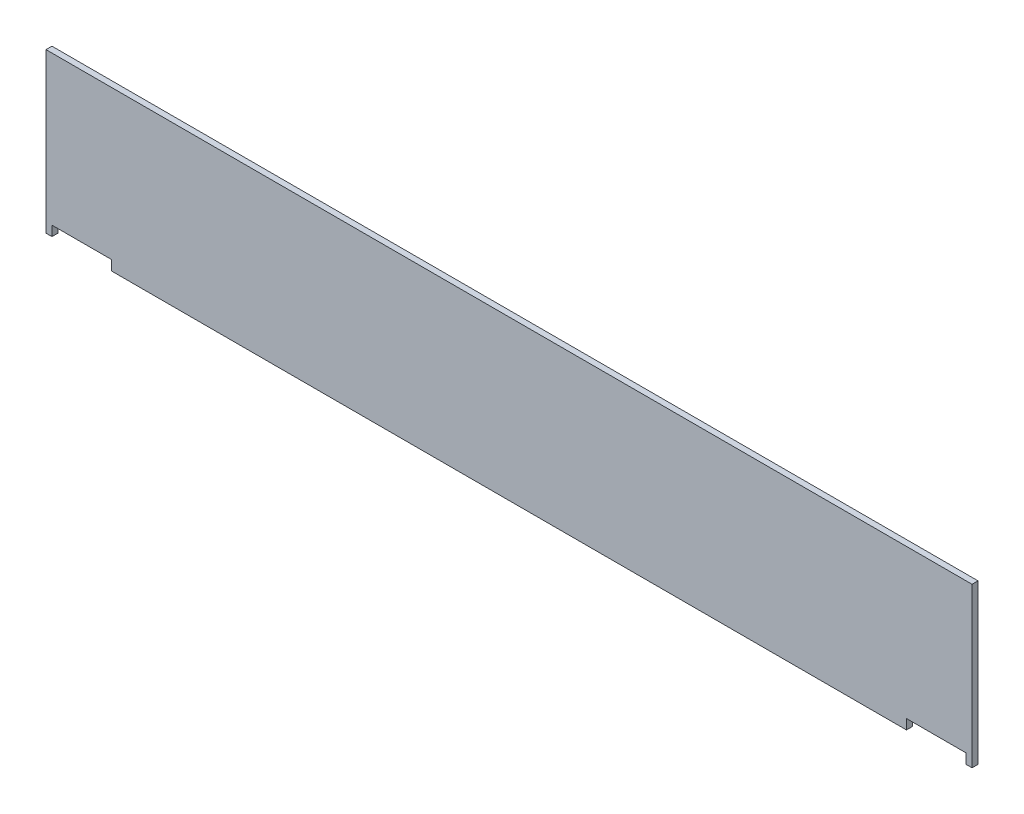
from build123d import *

# Parameters (mm, degrees)
P_IDAT_VYSUNUT_M1_DEPTH = 3


with BuildPart() as part:
    # Skica1 → Přidat vysunutím1 (new body)
    with BuildSketch(Plane.XY):
        Polygon((-226.652524032, 0), (-226.652524032, 80), (239.347475968, 80), (239.347475968, 0), (236.347475968, 0), (236.347475968, 5), (206.347475968, 5), (206.347475968, 0), (-193.652524032, 0), (-193.652524032, 5), (-223.652524032, 5), (-223.652524032, 0), align=None)
    extrude(amount=P_IDAT_VYSUNUT_M1_DEPTH)


solid = part.part
